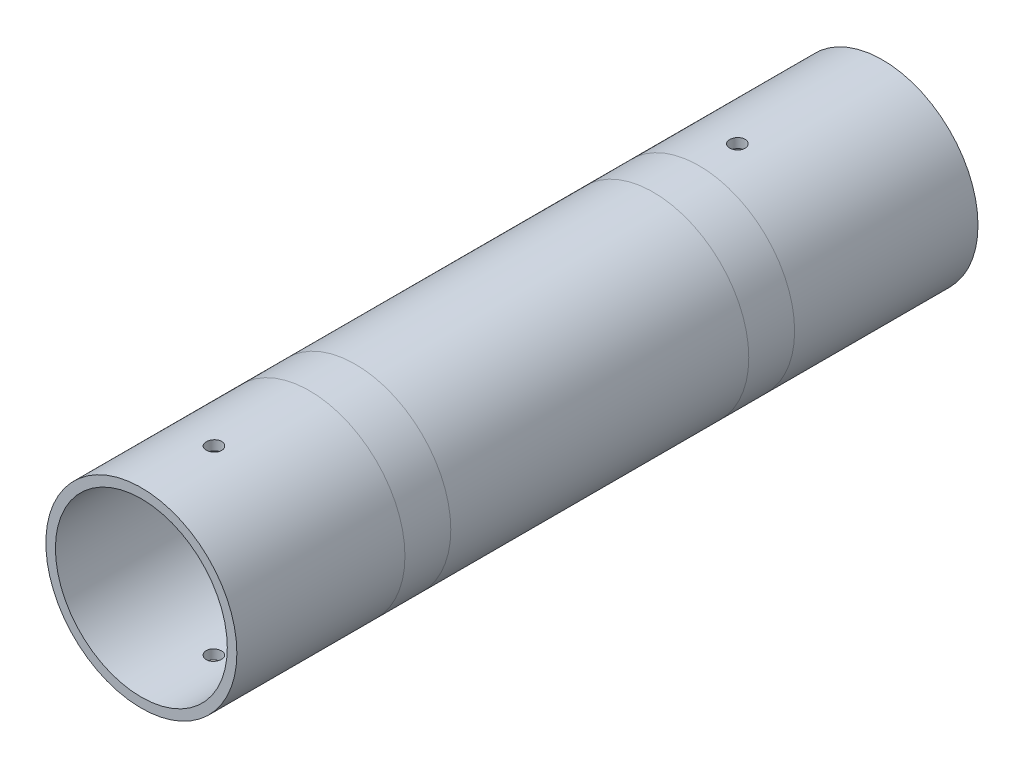
from build123d import *

# Parameters (mm, degrees)
SKETCH1_R               = 25
SKETCH1_R_2             = 22.5
BOSS_EXTRUDE1_DEPTH     = 194
CUT_EXTRUDE1_DEPTH      = 198.19533463
CUT_EXTRUDE1_DEPTH_BACK = 198.19533463
SKETCH10_R              = 2


with BuildPart() as part:
    # Sketch1 → Boss-Extrude1 (new body)
    with BuildSketch(Plane.XY):
        Circle(SKETCH1_R)
        Circle(SKETCH1_R_2, mode=Mode.SUBTRACT)
    extrude(amount=-BOSS_EXTRUDE1_DEPTH)

    # Sketch10 → Cut-Extrude1 (cut, two sides: drawn at the far end of the back side and taken through both)
    with BuildSketch(Plane(origin=(0, 0, 0), x_dir=(1, 0, 0), z_dir=(0, 1, 0)).offset(-CUT_EXTRUDE1_DEPTH_BACK)):
        with Locations(Location((0, 156, 0), (0, 0, 270))):
            Circle(SKETCH10_R)
        with Locations(Location((0, 19, 0), (0, 0, 270))):
            Circle(SKETCH10_R)
    extrude(amount=CUT_EXTRUDE1_DEPTH + CUT_EXTRUDE1_DEPTH_BACK, mode=Mode.SUBTRACT)


solid = part.part
